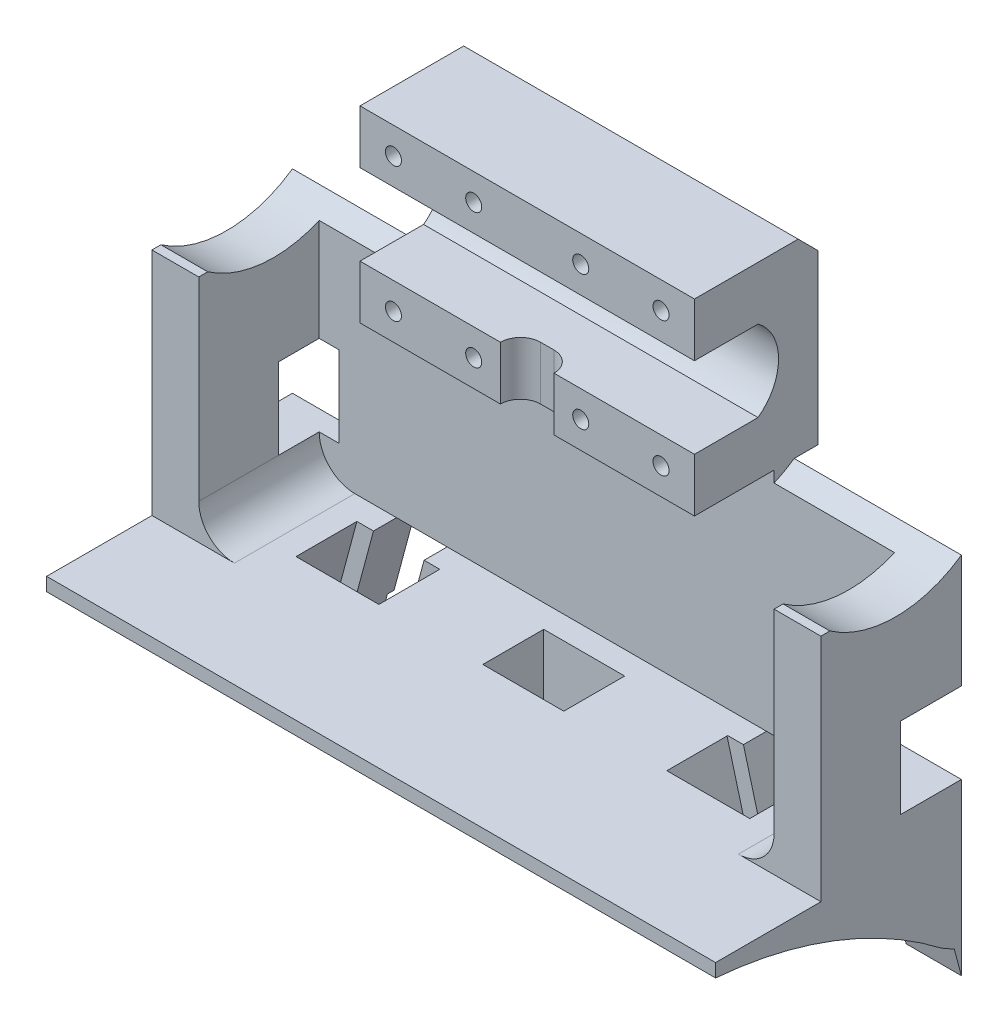
from build123d import *

# Parameters (mm, degrees)
BASE_DEPTH                  = 3
CROQUIS2_W                  = 50
CROQUIS2_H                  = 28.1
SALIENTE_EXTRUIR2_DEPTH     = 15.5
CORTAR_EXTRUIR1_REACH       = 92.946
CORTAR_EXTRUIR2_REACH       = 88.329
CROQUIS15_W                 = 100
CROQUIS15_H                 = 54.46
SALIENTE_EXTRUIR3_DEPTH     = 3.6
CORTAR_EXTRUIR3_DEPTH       = 3.6
CROQUIS5_R                  = 1.2
CORTAR_EXTRUIR4_DEPTH       = 6
CORTAR_EXTRUIR7_DEPTH       = 113.455546773
SALIENTE_EXTRUIR5_DEPTH     = 100
CHAFL_N1_SIZE               = 3
CORTAR_EXTRUIR9_DEPTH       = 25
CORTAR_EXTRUIR10_START      = -25
CORTAR_EXTRUIR10_DEPTH      = 25
CORTAR_EXTRUIR11_DEPTH      = 18
CORTAR_EXTRUIR14_DEPTH      = 10
CORTAR_EXTRUIR14_DEPTH_BACK = 10
CROQUIS45_W                 = 12.1
CROQUIS45_H                 = 9.1
CORTAR_EXTRUIR15_DEPTH      = 10
CORTAR_EXTRUIR15_DEPTH_BACK = 10
CROQUIS49_W                 = 12.1
CROQUIS49_H                 = 9.1
CROQUIS63_W                 = 12.1
CROQUIS63_H                 = 9.1
CORTAR_EXTRUIR19_DEPTH      = 30
CROQUIS64_W                 = 9.1
CROQUIS64_H                 = 12.1
CORTAR_EXTRUIR20_DEPTH      = 10
CROQUIS66_W                 = 9.1
CROQUIS66_H                 = 12.1
CORTAR_EXTRUIR21_DEPTH      = 10
SALIENTE_EXTRUIR11_DEPTH    = 18
CROQUIS73_R                 = 1.7
CORTAR_EXTRUIR22_DEPTH      = 10
CROQUIS75_W                 = 13.5
CROQUIS75_H                 = 7.5
CORTAR_EXTRUIR26_DEPTH      = 1
CORTAR_EXTRUIR27_DEPTH      = 76.642628391


with BuildPart() as part:
    # Croquis1 → Base (new body)
    with BuildSketch(Plane.XY):
        Polygon((-50, -48), (50, -48), (50, 19.9), (25, 19.9), (25, 48), (-25, 48), (-25, 19.9), (-50, 19.9), align=None)
    extrude(amount=BASE_DEPTH)

    # Croquis2 → Saliente-Extruir2 (add)
    with BuildSketch(Plane.XY.offset(3)):
        with Locations((0, 33.95)):
            Rectangle(CROQUIS2_W, CROQUIS2_H)
    extrude(amount=SALIENTE_EXTRUIR2_DEPTH)

    # Croquis3 → Cortar-Extruir1 (cut, up to next)
    with BuildSketch(Plane.ZY.offset(25), mode=Mode.PRIVATE) as cortar_extruir1_sk1:
        with BuildLine():
            Line((18.5, 40), (18.5, 27.9))
            Line((18.5, 27.9), (9, 27.9))
            ThreePointArc((9, 27.9), (5.931506818, 33.95), (9, 40))
            Line((9, 40), (18.5, 40))
        make_face()
    cortar_extruir1_tool1 = extrude(cortar_extruir1_sk1.sketch, amount=-CORTAR_EXTRUIR1_REACH, mode=Mode.PRIVATE) & part.part
    add(cortar_extruir1_tool1.solids().sort_by_distance((-25, 33.95, 12.643483))[0], mode=Mode.SUBTRACT)

    # Croquis4 → Cortar-Extruir2 (cut, up to next)
    with BuildSketch(Plane.XZ.offset(-19.9), mode=Mode.PRIVATE) as cortar_extruir2_sk1:
        with BuildLine():
            Line((1, 15.5), (-1, 15.5))
            ThreePointArc((-1, 15.5), (-3.121320344, 16.378679656), (-4, 18.5))
            Line((-4, 18.5), (4, 18.5))
            ThreePointArc((4, 18.5), (3.121320344, 16.378679656), (1, 15.5))
        make_face()
    cortar_extruir2_tool1 = extrude(cortar_extruir2_sk1.sketch, amount=-CORTAR_EXTRUIR2_REACH, mode=Mode.PRIVATE) & part.part
    add(cortar_extruir2_tool1.solids().sort_by_distance((0, 19.9, 17.159196))[0], mode=Mode.SUBTRACT)

    # Croquis15 → Saliente-Extruir3 (add)
    with BuildSketch(Plane.XY.offset(3)):
        with Locations((0, -7.33)):
            Rectangle(CROQUIS15_W, CROQUIS15_H)
    extrude(amount=SALIENTE_EXTRUIR3_DEPTH)

    # Croquis16 → Cortar-Extruir3 (cut)
    with BuildSketch(Plane(origin=(0, 0, 0), x_dir=(-1, 0, 0), z_dir=(0, 0, -1))):
        Polygon((25, 19.9), (50, 19.9), (50, -48), (-50, -48), (-50, 19.9), (-25, 19.9), align=None)
    extrude(amount=-CORTAR_EXTRUIR3_DEPTH, mode=Mode.SUBTRACT)

    # Croquis5 → Cortar-Extruir4 (cut)
    with BuildSketch(Plane.XY.offset(18.5)):
        with Locations((-20, 44)):
            Circle(CROQUIS5_R)
        with Locations((-8, 44)):
            Circle(CROQUIS5_R)
        with Locations((-20, 23.9)):
            Circle(CROQUIS5_R)
        with Locations((-8, 23.9)):
            Circle(CROQUIS5_R)
        with Locations((8, 44)):
            Circle(CROQUIS5_R)
        with Locations((20, 44)):
            Circle(CROQUIS5_R)
        with Locations((8, 23.9)):
            Circle(CROQUIS5_R)
        with Locations((20, 23.9)):
            Circle(CROQUIS5_R)
    extrude(amount=-CORTAR_EXTRUIR4_DEPTH, mode=Mode.SUBTRACT)

    # Croquis22 → Cortar-Extruir7 (cut, through all)
    with BuildSketch(Plane.ZY.offset(50)):
        Polygon((4.66, -30.6), (6.6, -29.479940478), (6.6, -34.56), (3.6, -34.56), align=None)
    extrude(amount=-CORTAR_EXTRUIR7_DEPTH, mode=Mode.SUBTRACT)

    # Croquis24 → Saliente-Extruir5 (add, through all)
    with BuildSketch(Plane.ZY.offset(50)):
        with BuildLine():
            Line((24.6, -14.479940478), (40.345333467, -14.479940478))
            Line((40.345333467, -14.479940478), (40.345333467, -16.479940478))
            ThreePointArc((40.345333467, -16.479940478), (22.538840373, -20.555918791), (6.6, -29.479940478))
            Line((6.6, -29.479940478), (6.6, 19.9))
            Line((6.6, 19.9), (24.6, 19.9))
            Line((24.6, 19.9), (24.6, -14.479940478))
        make_face()
    extrude(amount=-SALIENTE_EXTRUIR5_DEPTH)

    # Chaflán1
    chafl_n1_edges = [part.edges().sort_by_distance(p)[0] for p in [
        (0, 48, 0),
    ]]
    chamfer(chafl_n1_edges, length=CHAFL_N1_SIZE)

    # Croquis25 → Cortar-Extruir9 (cut)
    with BuildSketch(Plane.ZY.offset(50)):
        with BuildLine():
            Line((23.26, 19.9), (3.6, 19.9))
            ThreePointArc((3.6, 19.9), (13.43, 16.802656182), (23.26, 19.9))
        make_face()
    extrude(amount=-CORTAR_EXTRUIR9_DEPTH, mode=Mode.SUBTRACT)

    # Croquis26 → Cortar-Extruir10 (cut)
    with BuildSketch(Plane(origin=(50, 0, 0), x_dir=(0, 0, -1), z_dir=(1, 0, 0)).offset(CORTAR_EXTRUIR10_START)):
        with BuildLine():
            Line((-3.6, 19.9), (-23.26, 19.9))
            ThreePointArc((-23.26, 19.9), (-13.43, 16.802656182), (-3.6, 19.9))
        make_face()
    extrude(amount=CORTAR_EXTRUIR10_DEPTH, mode=Mode.SUBTRACT)

    # Croquis28 → Cortar-Extruir11 (cut)
    with BuildSketch(Plane.XY.offset(24.6)):
        Polygon((-43, -9.479940478), (-43, 19.9), (43, 19.9), (43, -9.479940478), (43, -14.479940478), (-43, -14.479940478), align=None)
    extrude(amount=-CORTAR_EXTRUIR11_DEPTH, mode=Mode.SUBTRACT)

    # Croquis45 → Cortar-Extruir14 (cut, two sides: drawn at the far end of the back side and taken through both)
    with BuildSketch(Plane(origin=(-7.65, -28.550188678, 0), x_dir=(-0.9659258262890681, 0.25881904510252135, 0), z_dir=(-0.25881904510252135, -0.9659258262890681, 0)).offset(-CORTAR_EXTRUIR14_DEPTH_BACK)):
        with Locations((22.96204173, -14.6)):
            Rectangle(CROQUIS45_W, CROQUIS45_H)
    extrude(amount=CORTAR_EXTRUIR14_DEPTH + CORTAR_EXTRUIR14_DEPTH_BACK, mode=Mode.SUBTRACT)

    # Croquis49 → Cortar-Extruir15 (cut, two sides: drawn at the far end of the back side and taken through both)
    with BuildSketch(Plane(origin=(7.65, -28.550188678, 0), x_dir=(-0.96592582628907, -0.2588190451025146, 0), z_dir=(0.2588190451025145, -0.9659258262890699, 0)).offset(-CORTAR_EXTRUIR15_DEPTH_BACK)):
        with Locations((-22.96204173, -14.6)):
            Rectangle(CROQUIS49_W, CROQUIS49_H)
    extrude(amount=CORTAR_EXTRUIR15_DEPTH + CORTAR_EXTRUIR15_DEPTH_BACK, mode=Mode.SUBTRACT)

    # Croquis63 → Cortar-Extruir19 (cut)
    with BuildSketch(Plane(origin=(0, -14.479940478, 0), x_dir=(1, 0, 0), z_dir=(0, 1, 0))):
        with Locations((0.063130338, -14.6)):
            Rectangle(CROQUIS63_W, CROQUIS63_H)
    extrude(amount=-CORTAR_EXTRUIR19_DEPTH, mode=Mode.SUBTRACT)

    # Croquis64 → Cortar-Extruir20 (cut)
    with BuildSketch(Plane.ZY.offset(50)):
        with Locations((8.15, -3.1)):
            Rectangle(CROQUIS64_W, CROQUIS64_H)
    extrude(amount=-CORTAR_EXTRUIR20_DEPTH, mode=Mode.SUBTRACT)

    # Croquis66 → Cortar-Extruir21 (cut)
    with BuildSketch(Plane(origin=(50, 0, 0), x_dir=(0, 0, -1), z_dir=(1, 0, 0))):
        with Locations((-8.15, -3.1)):
            Rectangle(CROQUIS66_W, CROQUIS66_H)
    extrude(amount=-CORTAR_EXTRUIR21_DEPTH, mode=Mode.SUBTRACT)

    # Croquis70 → Saliente-Extruir11 (add)
    with BuildSketch(Plane.XY.offset(6.6)):
        with BuildLine():
            Line((-43, -9.15), (-43, -14.479940478))
            Line((-43, -14.479940478), (-37.670059522, -14.479940478))
            ThreePointArc((-37.670059522, -14.479940478), (-41.438896577, -12.918837055), (-43, -9.15))
        make_face()
        with BuildLine():
            Line((43, -14.479940478), (43, -9.15))
            ThreePointArc((43, -9.15), (41.438896577, -12.918837055), (37.670059522, -14.479940478))
            Line((37.670059522, -14.479940478), (43, -14.479940478))
        make_face()
    extrude(amount=SALIENTE_EXTRUIR11_DEPTH)

    # Croquis73 → Cortar-Extruir22 (cut)
    with BuildSketch(Plane(origin=(0, 0, 3.6), x_dir=(-1, 0, 0), z_dir=(0, 0, -1))):
        with Locations((-45, 11.425)):
            Circle(CROQUIS73_R)
        with Locations((45, 11.425)):
            Circle(CROQUIS73_R)
        with Locations((45, -20.575)):
            Circle(CROQUIS73_R)
        with Locations((-45, -20.575)):
            Circle(CROQUIS73_R)
    extrude(amount=-CORTAR_EXTRUIR22_DEPTH, mode=Mode.SUBTRACT)

    # Croquis75 → Cortar-Extruir26 (cut)
    with BuildSketch(Plane(origin=(0, 0, 3.6), x_dir=(-1, 0, 0), z_dir=(0, 0, -1))):
        with Locations((-35, -30.81)):
            Rectangle(CROQUIS75_W, CROQUIS75_H)
        with Locations((35, -30.81)):
            Rectangle(CROQUIS75_W, CROQUIS75_H)
    extrude(amount=-CORTAR_EXTRUIR26_DEPTH, mode=Mode.SUBTRACT)

    # Croquis76 → Cortar-Extruir27 (cut, through all)
    with BuildSketch(Plane.XY.offset(10.05)):
        Polygon((-29.251017738, -34.56), (-36.815799839, -34.56), (-31.435364106, -14.479940478), (-23.870582005, -14.479940478), align=None)
        Polygon((29.251017738, -34.56), (23.870582005, -14.479940478), (31.435364106, -14.479940478), (36.815799839, -34.56), align=None)
    extrude(amount=-CORTAR_EXTRUIR27_DEPTH, mode=Mode.SUBTRACT)


solid = part.part
